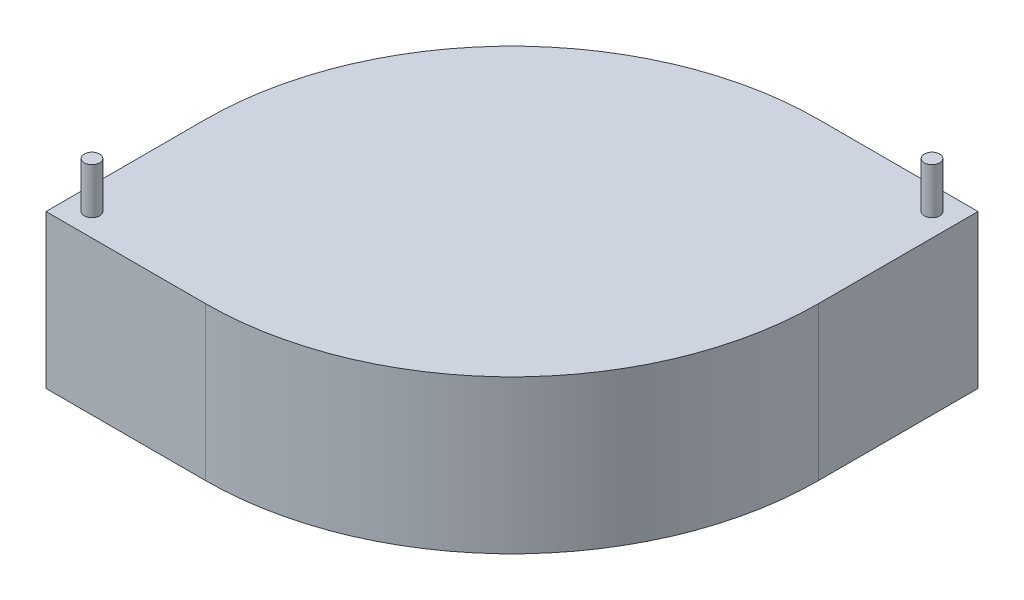
from build123d import *

# Parameters (mm, degrees)
EXTRUDE_1_DEPTH = 100
SKETCH_2_R      = 5
EXTRUDE_2_DEPTH = 30


with BuildPart() as part:
    # 草圖1 → 填料-伸長1 (new body)
    with BuildSketch(Plane(origin=(0, 0, 0), x_dir=(1, 0, 0), z_dir=(0, 1, 0))):
        with BuildLine():
            Line((0, 0), (104, 0))
            ThreePointArc((104, 0), (245.421356237, 58.578643763), (304, 200))
            Line((304, 200), (304, 304))
            Line((304, 304), (200, 304))
            ThreePointArc((200, 304), (58.578643763, 245.421356237), (0, 104))
            Line((0, 104), (0, 0))
        make_face()
    extrude(amount=EXTRUDE_1_DEPTH)

    # 草圖2 → 填料-伸長2 (add)
    with BuildSketch(Plane(origin=(0, 100, 0), x_dir=(1, 0, 0), z_dir=(0, 1, 0))):
        with Locations(Location((15, 15, 0), (0, 0, 90))):
            Circle(SKETCH_2_R)
        with Locations(Location((289, 289, 0), (0, 0, 90))):
            Circle(SKETCH_2_R)
    extrude(amount=EXTRUDE_2_DEPTH)


solid = part.part
